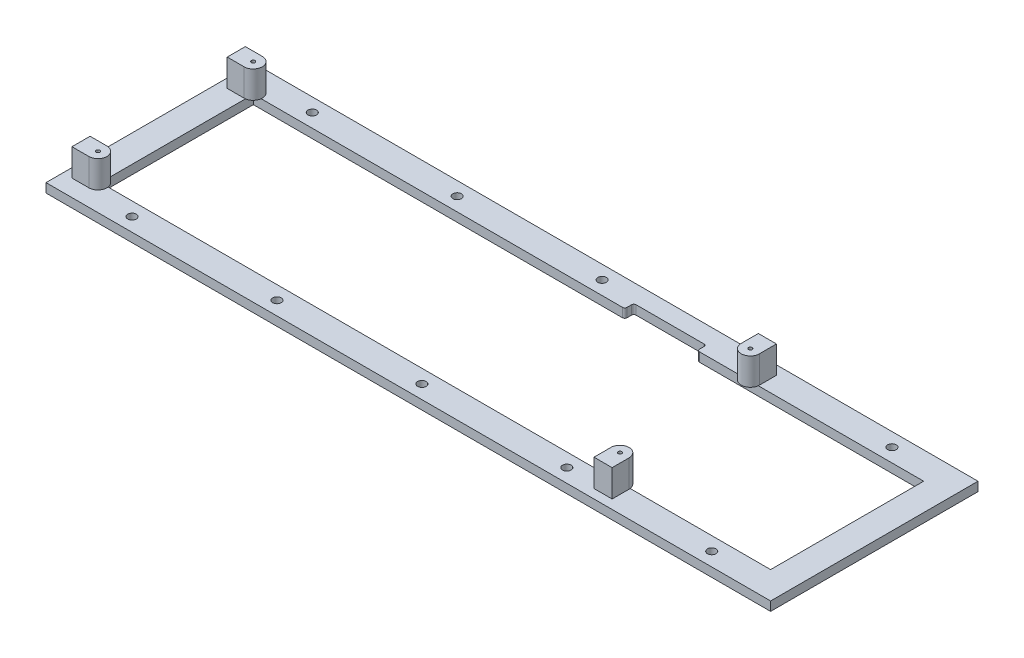
from build123d import *

# Parameters (mm, degrees)
SKETCH1_W           = 254
SKETCH1_H           = 72.69988
SKETCH1_R           = 1.5
BOSS_EXTRUDE1_DEPTH = 3.175
SKETCH1_7_R         = 0.635
BOSS_EXTRUDE2_DEPTH = 9.525


with BuildPart() as part:
    # Sketch1 → Boss-Extrude1 (new body)
    with BuildSketch(Plane(origin=(0, 0, 0), x_dir=(1, 0, 0), z_dir=(0, 1, 0))):
        with Locations((127, 36.34994)):
            Rectangle(SKETCH1_W, SKETCH1_H)
        with Locations((25.4, 4.7625)):
            Circle(SKETCH1_R, mode=Mode.SUBTRACT)
        with Locations((76.2, 4.7625)):
            Circle(SKETCH1_R, mode=Mode.SUBTRACT)
        with Locations((127, 4.7625)):
            Circle(SKETCH1_R, mode=Mode.SUBTRACT)
        with Locations((177.8, 4.7625)):
            Circle(SKETCH1_R, mode=Mode.SUBTRACT)
        with Locations((228.6, 4.7625)):
            Circle(SKETCH1_R, mode=Mode.SUBTRACT)
        with BuildLine():
            Line((244.475, 63.17488), (244.475, 9.525))
            Line((244.475, 9.525), (9.525, 9.525))
            Line((9.525, 9.525), (9.525, 63.17488))
            Line((9.525, 63.17488), (138.90625, 63.17488))
            ThreePointArc((138.90625, 63.17488), (139.467516008, 63.407363992), (139.7, 63.96863))
            Line((139.7, 63.96863), (139.7, 65.55613))
            ThreePointArc((139.7, 65.55613), (139.932483992, 66.117396008), (140.49375, 66.34988))
            Line((140.49375, 66.34988), (164.30625, 66.34988))
            ThreePointArc((164.30625, 66.34988), (164.867516008, 66.117396008), (165.1, 65.55613))
            Line((165.1, 65.55613), (165.1, 63.96863))
            ThreePointArc((165.1, 63.96863), (165.332483992, 63.407363992), (165.89375, 63.17488))
            Line((165.89375, 63.17488), (244.475, 63.17488))
        make_face(mode=Mode.SUBTRACT)
        with Locations((25.4, 67.93738)):
            Circle(SKETCH1_R, mode=Mode.SUBTRACT)
        with Locations((76.2, 67.93738)):
            Circle(SKETCH1_R, mode=Mode.SUBTRACT)
        with Locations((127, 67.93738)):
            Circle(SKETCH1_R, mode=Mode.SUBTRACT)
        with Locations((177.8, 67.93738)):
            Circle(SKETCH1_R, mode=Mode.SUBTRACT)
        with Locations((228.6, 67.93738)):
            Circle(SKETCH1_R, mode=Mode.SUBTRACT)
    extrude(amount=-BOSS_EXTRUDE1_DEPTH)

    # Sketch1<7> → Boss-Extrude2 (add)
    # profile 1 of 4: a face of its own
    with BuildSketch(Plane(origin=(0, 0, 0), x_dir=(1, 0, 0), z_dir=(0, 1, 0))):
        with BuildLine():
            Line((180.1749, 69.52488), (186.5249, 69.52488))
            Line((186.5249, 69.52488), (186.5249, 63.533223536))
            ThreePointArc((186.5249, 63.533223536), (183.3499, 60.358223536), (180.1749, 63.533223536))
            Line((180.1749, 63.533223536), (180.1749, 69.52488))
        make_face()
        with Locations((183.3499, 63.533223536)):
            Circle(SKETCH1_7_R, mode=Mode.SUBTRACT)
    # profile 2 of 4: a face of its own
    with BuildSketch(Plane(origin=(0, 0, 0), x_dir=(1, 0, 0), z_dir=(0, 1, 0))):
        with BuildLine():
            Line((188.9252, 9.10082), (188.9252, 3.175))
            Line((188.9252, 3.175), (195.2752, 3.175))
            Line((195.2752, 3.175), (195.2752, 9.10082))
            ThreePointArc((195.2752, 9.10082), (192.1002, 12.27582), (188.9252, 9.10082))
        make_face()
        with Locations((192.1002, 9.10082)):
            Circle(SKETCH1_7_R, mode=Mode.SUBTRACT)
    # profile 3 of 4: a face of its own
    with BuildSketch(Plane(origin=(0, 0, 0), x_dir=(1, 0, 0), z_dir=(0, 1, 0))):
        with BuildLine():
            Line((3.175, 12.27582), (9.10082, 12.27582))
            ThreePointArc((9.10082, 12.27582), (12.27582, 9.10082), (9.10082, 5.92582))
            Line((9.10082, 5.92582), (3.175, 5.92582))
            Line((3.175, 5.92582), (3.175, 12.27582))
        make_face()
        with Locations((9.10082, 9.10082)):
            Circle(SKETCH1_7_R, mode=Mode.SUBTRACT)
    # profile 4 of 4: a face of its own
    with BuildSketch(Plane(origin=(0, 0, 0), x_dir=(1, 0, 0), z_dir=(0, 1, 0))):
        with BuildLine():
            Line((3.175, 66.708223536), (9.10082, 66.708223536))
            ThreePointArc((9.10082, 66.708223536), (12.27582, 63.533223536), (9.10082, 60.358223536))
            Line((9.10082, 60.358223536), (3.175, 60.358223536))
            Line((3.175, 60.358223536), (3.175, 66.708223536))
        make_face()
        with Locations((9.10082, 63.533223536)):
            Circle(SKETCH1_7_R, mode=Mode.SUBTRACT)
    extrude(amount=BOSS_EXTRUDE2_DEPTH)


solid = part.part
